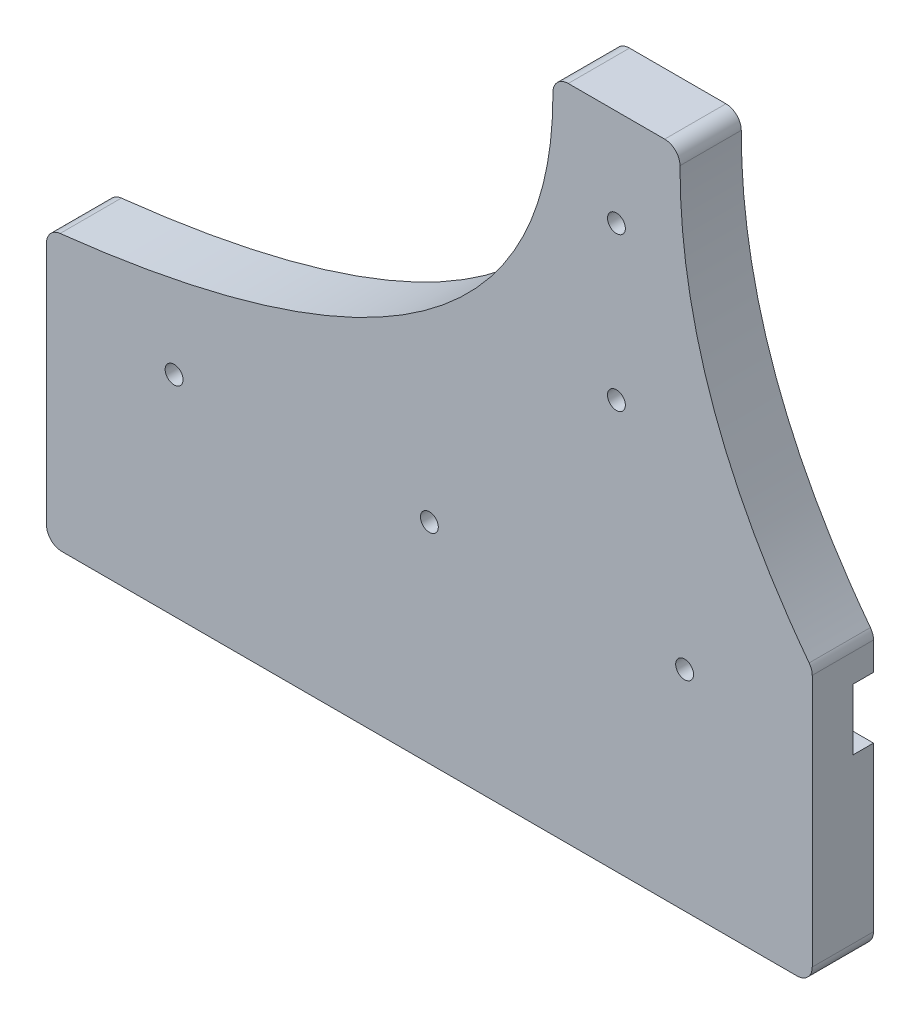
from build123d import *

# Parameters (mm, degrees)
SKIZZE1_R                       = 1.75
AUFSATZ_LINEAR_AUSTRAGEN1_DEPTH = 12
SKIZZE1_4_W                     = 150
SKIZZE1_4_H                     = 12
SKIZZE1_4_W_2                   = 12
SKIZZE1_4_H_2                   = 55
SKIZZE1_4_R                     = 1.75
SCHNITT_LINEAR_AUSTRAGEN2_DEPTH = 4
VERRUNDUNG1_R                   = 3


with BuildPart() as part:
    # Skizze1 → Aufsatz-Linear austragen1 (new body)
    with BuildSketch(Plane.XY):
        with BuildLine():
            Line((49.14, 88), (24.14, 88))
            add(Edge.make_bspline(
                [(24.14, 88), (26.807525043, 22.962561466), (-75, 12.5)],
                knots=[0, 0, 0, 1, 1, 1], degree=2))
            Line((-75, 12.5), (-75, -41))
            Line((-75, -41), (75, -41))
            Line((75, -41), (75, 12.5))
            add(Edge.make_bspline(
                [(49.14, 88), (47.999428855, 47.699903884), (75, 12.5)],
                knots=[0, 0, 0, 1, 1, 1], degree=2))
        make_face()
        with Locations((50, 0)):
            Circle(SKIZZE1_R, mode=Mode.SUBTRACT)
        with Locations((-50, 0)):
            Circle(SKIZZE1_R, mode=Mode.SUBTRACT)
        Circle(SKIZZE1_R, mode=Mode.SUBTRACT)
        with Locations((36.64, 39)):
            Circle(SKIZZE1_R, mode=Mode.SUBTRACT)
        with Locations((36.64, 69)):
            Circle(SKIZZE1_R, mode=Mode.SUBTRACT)
    extrude(amount=AUFSATZ_LINEAR_AUSTRAGEN1_DEPTH)

    # Skizze1<4> → Schnitt-Linear austragen2 (cut)
    # profile 1 of 2: a face of its own
    with BuildSketch(Plane.XY):
        Rectangle(SKIZZE1_4_W, SKIZZE1_4_H)
    # profile 2 of 2: a face of its own
    with BuildSketch(Plane.XY):
        with Locations((36.64, 54)):
            Rectangle(SKIZZE1_4_W_2, SKIZZE1_4_H_2)
        with Locations((36.64, 39)):
            Circle(SKIZZE1_4_R, mode=Mode.SUBTRACT)
        with Locations((36.64, 69)):
            Circle(SKIZZE1_4_R, mode=Mode.SUBTRACT)
    extrude(amount=SCHNITT_LINEAR_AUSTRAGEN2_DEPTH, mode=Mode.SUBTRACT)

    # Verrundung1
    verrundung1_edges = [part.edges().sort_by_distance(p)[0] for p in [
        (75, -41, 6),
        (75, 12.5, 6),
        (49.14, 88, 6),
        (-75, -41, 6),
        (-75, 12.5, 6),
        (24.14, 88, 6),
    ]]
    fillet(verrundung1_edges, radius=VERRUNDUNG1_R)


solid = part.part
